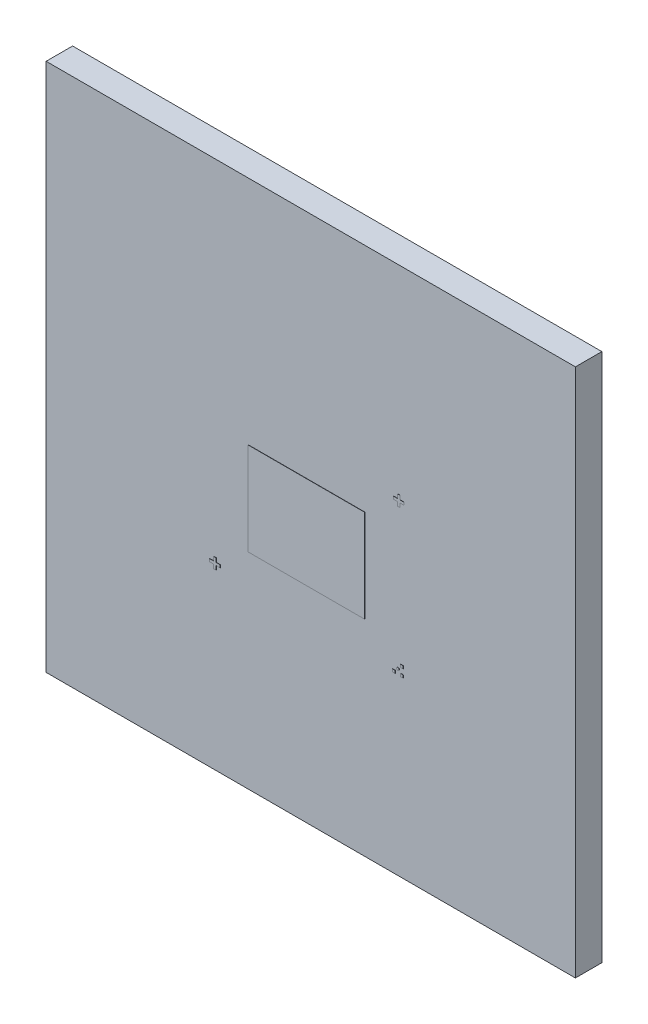
from build123d import *

# Parameters (mm, degrees)
SKETCH1_W             = 20
SKETCH1_H             = 20
BOSS_EXTRUDE1_DEPTH   = 1
SKETCH2_R             = 0.05
BOSS_EXTRUDE2_DEPTH   = 0.01
BOSS_EXTRUDE2_2_DEPTH = 0.01
SKETCH2_W             = 0.1
SKETCH2_H             = 0.102678481
BOSS_EXTRUDE2_3_DEPTH = 0.01
BOSS_EXTRUDE2_4_DEPTH = 0.01
BOSS_EXTRUDE2_5_DEPTH = 0.01
BOSS_EXTRUDE2_6_DEPTH = 0.01
SKETCH3_W             = 4.4
SKETCH3_H             = 3.5
BOSS_EXTRUDE3_DEPTH   = 0.01


with BuildPart() as part:
    # Sketch1 → Boss-Extrude1 (new body)
    with BuildSketch(Plane.XY):
        with Locations((10, 10)):
            Rectangle(SKETCH1_W, SKETCH1_H)
    extrude(amount=BOSS_EXTRUDE1_DEPTH)


with BuildPart() as body_2:
    # Sketch2 → Boss-Extrude2 (new body)
    with BuildSketch(Plane.XY.offset(1)):
        with Locations((13.299260569, 6.769637469)):
            Circle(SKETCH2_R)
    extrude(amount=BOSS_EXTRUDE2_DEPTH)


with BuildPart() as body_3:
    # Sketch2 → Boss-Extrude2 2 (new body)
    with BuildSketch(Plane.XY.offset(1)):
        Polygon((6.334974855, 6.969637469), (6.334974855, 6.819637469), (6.184974855, 6.819637469), (6.184974855, 6.719637469), (6.334974855, 6.719637469), (6.334974855, 6.569637469), (6.434974855, 6.569637469), (6.434974855, 6.719637469), (6.584974855, 6.719637469), (6.584974855, 6.819637469), (6.434974855, 6.819637469), (6.434974855, 6.969637469), align=None)
    extrude(amount=BOSS_EXTRUDE2_2_DEPTH)


with BuildPart() as body_4:
    # Sketch2 → Boss-Extrude2 3 (new body)
    with BuildSketch(Plane.XY.offset(1)):
        with Locations((13.449260569, 6.919637469)):
            Rectangle(SKETCH2_W, SKETCH2_H)
    extrude(amount=BOSS_EXTRUDE2_3_DEPTH)


with BuildPart() as body_5:
    # Sketch2 → Boss-Extrude2 4 (new body)
    with BuildSketch(Plane.XY.offset(1)):
        with Locations((13.449260569, 6.619637469)):
            Rectangle(SKETCH2_W, SKETCH2_H)
    extrude(amount=BOSS_EXTRUDE2_4_DEPTH)


with BuildPart() as body_6:
    # Sketch2 → Boss-Extrude2 5 (new body)
    with BuildSketch(Plane.XY.offset(1)):
        with Locations((13.149260569, 6.619637469)):
            Rectangle(SKETCH2_W, SKETCH2_H)
    extrude(amount=BOSS_EXTRUDE2_5_DEPTH)


with BuildPart() as body_7:
    # Sketch2 → Boss-Extrude2 6 (new body)
    with BuildSketch(Plane.XY.offset(1)):
        Polygon((13.278816913, 12.489566126), (13.278816913, 12.339566126), (13.128816913, 12.339566126), (13.128816913, 12.239566126), (13.278816913, 12.239566126), (13.278816913, 12.089566126), (13.378816913, 12.089566126), (13.378816913, 12.239566126), (13.528816913, 12.239566126), (13.528816913, 12.339566126), (13.378816913, 12.339566126), (13.378816913, 12.489566126), align=None)
    extrude(amount=BOSS_EXTRUDE2_6_DEPTH)


with BuildPart() as body_8:
    # Sketch3 → Boss-Extrude3 (new body)
    with BuildSketch(Plane.XY.offset(1)):
        with Locations((9.842117712, 9.519637469)):
            Rectangle(SKETCH3_W, SKETCH3_H)
    extrude(amount=BOSS_EXTRUDE3_DEPTH)


solid = Compound([part.part, body_2.part, body_3.part, body_4.part, body_5.part, body_6.part, body_7.part, body_8.part])
